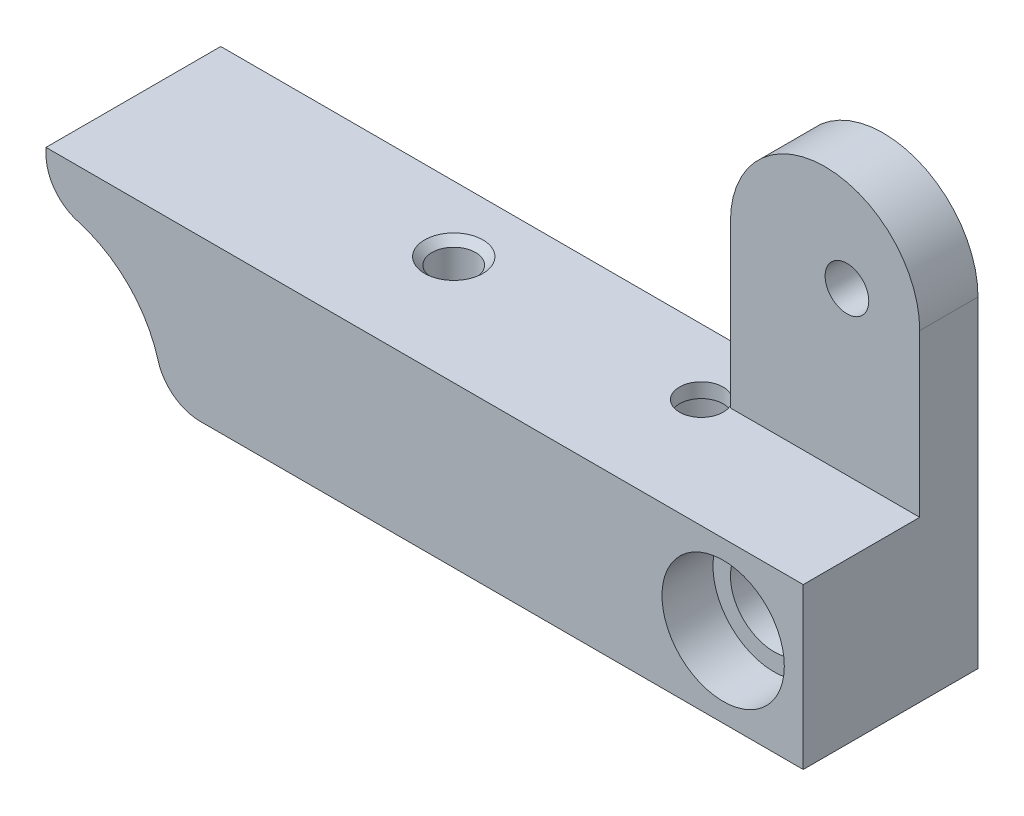
from build123d import *

# Parameters (mm, degrees)
SKETCH1_W           = 52
SKETCH1_H           = 11
BOSS_EXTRUDE1_DEPTH = 12
SKETCH3_W           = 12
SKETCH3_H           = 8
CUT_REVOLVE1_ANGLE  = 90
SKETCH4_W           = 13
SKETCH4_H           = 4
BOSS_EXTRUDE2_DEPTH = 17.603
CUT_EXTRUDE1_DEPTH  = 60.884318557
SKETCH7_R           = 1.5
CUT_EXTRUDE2_DEPTH  = 60.884318557
SKETCH8_R           = 4.2
CUT_EXTRUDE3_DEPTH  = 3.5
SKETCH9_R           = 3
CUT_EXTRUDE4_DEPTH  = 7.5
SKETCH10_R          = 1.6
CUT_EXTRUDE5_DEPTH  = 61.358359893
SKETCH11_R          = 1.5
CUT_EXTRUDE6_DEPTH  = 61.548588827
SKETCH13_R          = 3
CUT_EXTRUDE7_DEPTH  = 10
CHAMFER3_SIZE       = 0.5
FILLET11_R          = 3
FILLET12_R          = 3


with BuildPart() as part:
    # Sketch1 → Boss-Extrude1 (new body)
    with BuildSketch(Plane.XY):
        with Locations((26, 5.5)):
            Rectangle(SKETCH1_W, SKETCH1_H)
    extrude(amount=BOSS_EXTRUDE1_DEPTH)

    # Sketch3 → Cut-Revolve1 (revolve, cut)
    with BuildSketch(Plane.ZY):
        with Locations((6, 4)):
            Rectangle(SKETCH3_W, SKETCH3_H)
    revolve(axis=Axis((0, 0, 0), (0, 0, -1)), revolution_arc=CUT_REVOLVE1_ANGLE, mode=Mode.SUBTRACT)

    # Sketch4 → Boss-Extrude2 (add)
    with BuildSketch(Plane(origin=(0, 11, 0), x_dir=(1, 0, 0), z_dir=(0, 1, 0))):
        with Locations((45.5, -2)):
            Rectangle(SKETCH4_W, SKETCH4_H)
    extrude(amount=BOSS_EXTRUDE2_DEPTH)

    # Sketch6 → Cut-Extrude1 (cut, through all)
    with BuildSketch(Plane.XY.offset(4)):
        with BuildLine():
            ThreePointArc((45.5, 28.603), (50.096194078, 26.699194078), (52, 22.103))
            Line((52, 22.103), (52, 28.603))
            Line((52, 28.603), (45.5, 28.603))
        make_face()
        with BuildLine():
            Line((39, 28.603), (39, 22.103))
            ThreePointArc((39, 22.103), (40.903805922, 26.699194078), (45.5, 28.603))
            Line((45.5, 28.603), (39, 28.603))
        make_face()
    extrude(amount=-CUT_EXTRUDE1_DEPTH, mode=Mode.SUBTRACT)

    # Sketch7 → Cut-Extrude2 (cut, through all)
    with BuildSketch(Plane.XY.offset(4)):
        with Locations((47, 22.103)):
            Circle(SKETCH7_R)
    extrude(amount=-CUT_EXTRUDE2_DEPTH, mode=Mode.SUBTRACT)

    # Sketch8 → Cut-Extrude3 (cut)
    with BuildSketch(Plane.XY.offset(12)):
        with Locations((46.5, 5.5)):
            Circle(SKETCH8_R)
    extrude(amount=-CUT_EXTRUDE3_DEPTH, mode=Mode.SUBTRACT)

    # Sketch9 → Cut-Extrude4 (cut)
    with BuildSketch(Plane.XY.offset(8.5)):
        with Locations((46.5, 5.5)):
            Circle(SKETCH9_R)
    extrude(amount=-CUT_EXTRUDE4_DEPTH, mode=Mode.SUBTRACT)

    # Sketch10 → Cut-Extrude5 (cut, through all)
    with BuildSketch(Plane.XY.offset(1)):
        with Locations((46.5, 5.5)):
            Circle(SKETCH10_R)
    extrude(amount=-CUT_EXTRUDE5_DEPTH, mode=Mode.SUBTRACT)

    # Sketch11 → Cut-Extrude6 (cut, through all)
    with BuildSketch(Plane.XZ):
        with Locations(Location((37.5, 4.5, 0), (0, 0, 270))):
            Circle(SKETCH11_R)
        with Locations(Location((20.5, 4.5, 0), (0, 0, 270))):
            Circle(SKETCH11_R)
    extrude(amount=-CUT_EXTRUDE6_DEPTH, mode=Mode.SUBTRACT)

    # Sketch13 → Cut-Extrude7 (cut)
    with BuildSketch(Plane.XZ):
        with Locations(Location((37.5, 4.5, 0), (0, 0, 270))):
            Circle(SKETCH13_R)
    extrude(amount=-CUT_EXTRUDE7_DEPTH, mode=Mode.SUBTRACT)

    # Chamfer3
    chamfer3_edges = [part.edges().sort_by_distance(p)[0] for p in [
        (20.5, 11, 6),
        (20.5, 0, 6),
    ]]
    chamfer(chamfer3_edges, length=CHAMFER3_SIZE)

    # Fillet11
    fillet11_edges = [part.edges().sort_by_distance(p)[0] for p in [
        (0, 8, 6),
    ]]
    fillet(fillet11_edges, radius=FILLET11_R)

    # Fillet12
    fillet12_edges = [part.edges().sort_by_distance(p)[0] for p in [
        (8, 0, 6),
    ]]
    fillet(fillet12_edges, radius=FILLET12_R)


solid = part.part
